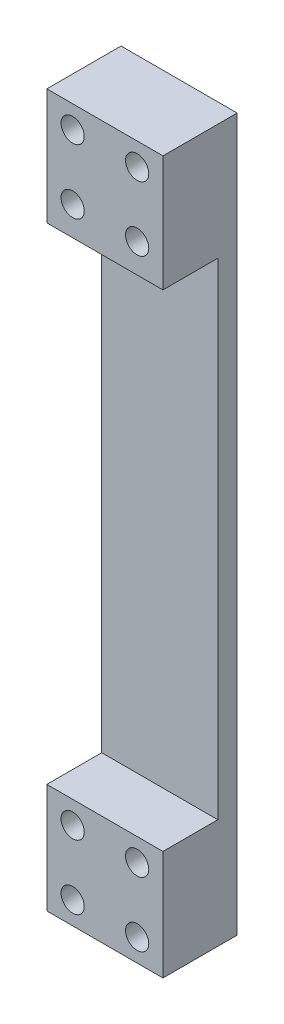
from build123d import *

# Parameters (mm, degrees)
SKETCH2_W            = 18
SKETCH2_H            = 110.4
BOSS_EXTRUDE1_DEPTH  = 3
BOSS_EXTRUDE2_DEPTH  = 8.50551692
M3_CLEARANCE_HOLE1_D = 3.6


with BuildPart() as part:
    # Sketch2 → Boss-Extrude1 (new body)
    with BuildSketch(Plane.XY.offset(-0.25)):
        with Locations((5.631550422, -23.757430205)):
            Rectangle(SKETCH2_W, SKETCH2_H)
    extrude(amount=-BOSS_EXTRUDE1_DEPTH)

    # Sketch3 → Boss-Extrude2 (add)
    with BuildSketch(Plane.XY.offset(-0.25)):
        Polygon((-3.368449578, 31.442569795), (14.631550422, 31.442569738), (14.631550364, 13.442569738), (-3.368449636, 13.442569795), align=None)
        Polygon((-3.368449578, -61.957430205), (14.631550422, -61.957430262), (14.631550422, -78.957430205), (-3.368449578, -78.957430205), align=None)
    extrude(amount=BOSS_EXTRUDE2_DEPTH)

    # M3 Clearance Hole1 (through all)
    with Locations(Plane.XY.offset(8.25551692)):
        with Locations((0.631550422, -65.457430205), (0.631550422, -75.457430205), (10.631550422, -75.457430205), (10.631550422, -65.457430205), (0.631550422, 17.942569795), (10.631550422, 17.942569795), (10.631550422, 27.942569795), (0.631550422, 27.942569795)):
            Hole(M3_CLEARANCE_HOLE1_D / 2)


solid = part.part
